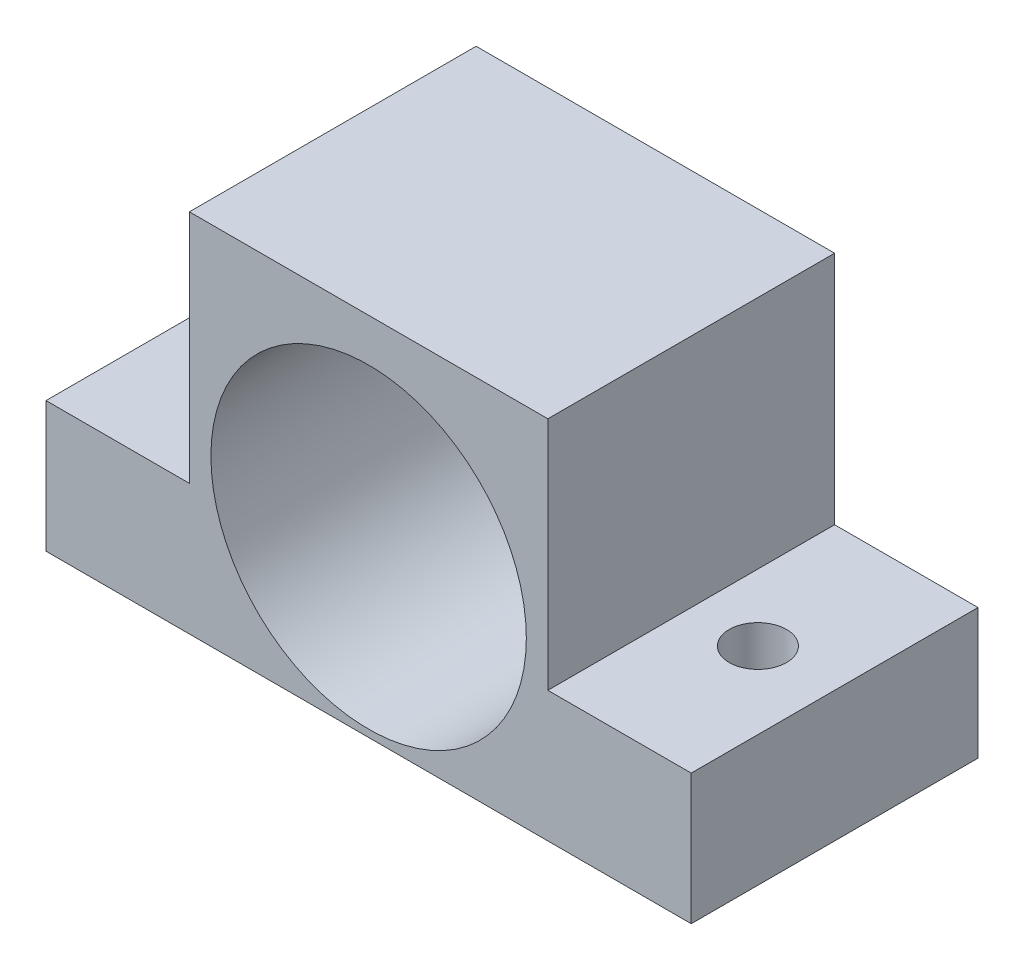
from build123d import *

# Parameters (mm, degrees)
SKETCH1_W           = 25
SKETCH1_H           = 25.5
SKETCH1_R           = 11
SKETCH1_W_2         = 10
SKETCH1_H_2         = 9.1
BOSS_EXTRUDE1_DEPTH = 20
SKETCH2_R           = 2
CUT_EXTRUDE1_DEPTH  = 9


with BuildPart() as part:
    # Sketch1 → Boss-Extrude1 (new body)
    # profile 1 of 3: a face of its own
    with BuildSketch(Plane.XY):
        with Locations((1.051746227, -4.75)):
            Rectangle(SKETCH1_W, SKETCH1_H)
        with Locations((1.051746227, -6)):
            Circle(SKETCH1_R, mode=Mode.SUBTRACT)
    # profile 2 of 3: a face of its own
    with BuildSketch(Plane.XY):
        with Locations((-16.448253773, -12.95)):
            Rectangle(SKETCH1_W_2, SKETCH1_H_2)
    # profile 3 of 3: a face of its own
    with BuildSketch(Plane.XY):
        with Locations((18.551746227, -12.95)):
            Rectangle(SKETCH1_W_2, SKETCH1_H_2)
    extrude(amount=BOSS_EXTRUDE1_DEPTH)

    # Sketch2 → Cut-Extrude1 (cut)
    with BuildSketch(Plane(origin=(0, -8.4, 0), x_dir=(1, 0, 0), z_dir=(0, 1, 0))):
        with Locations(Location((-16.798835848, -10, 0), (0, 0, 180))):
            Circle(SKETCH2_R)
        with Locations(Location((18.201164152, -10, 0), (0, 0, 180))):
            Circle(SKETCH2_R)
    extrude(amount=-CUT_EXTRUDE1_DEPTH, mode=Mode.SUBTRACT)


solid = part.part
